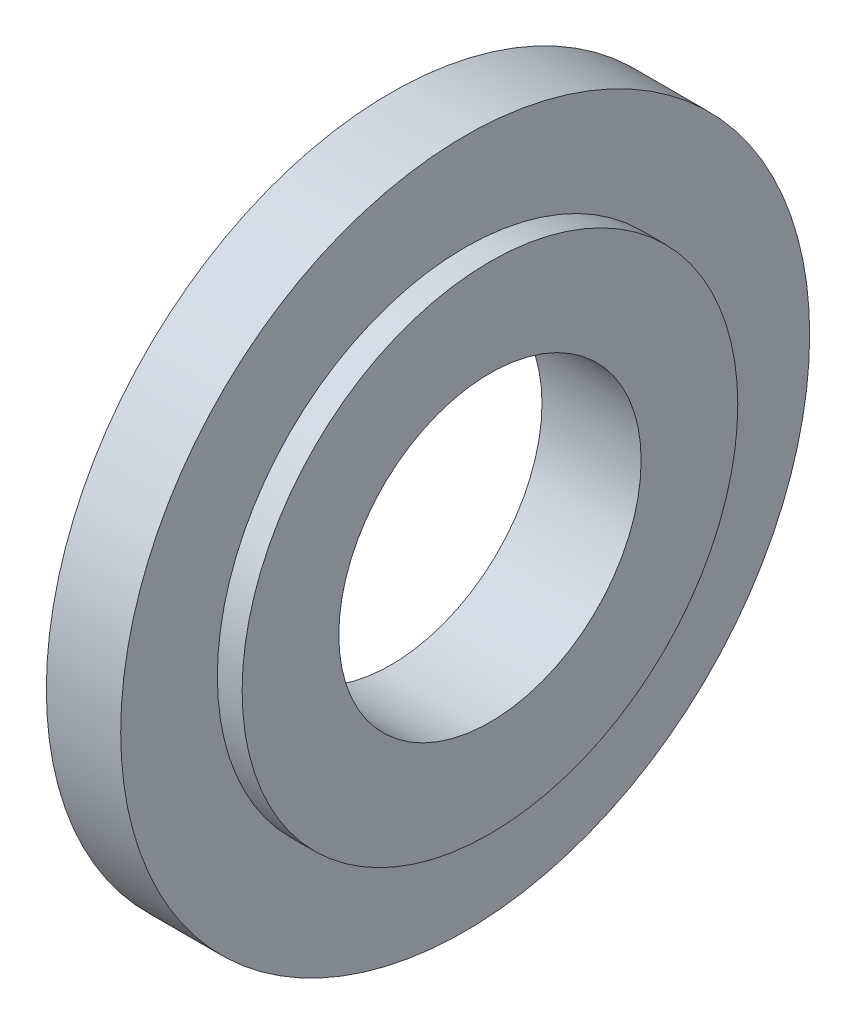
from build123d import *

# Parameters (mm, degrees)
FORMSENKUNG_F_R_M3_SENKSCHRAUBE_MIT_INNE_D           = 3.4
FORMSENKUNG_F_R_M3_SENKSCHRAUBE_MIT_INNE_CSINK_D     = 5.7
FORMSENKUNG_F_R_M3_SENKSCHRAUBE_MIT_INNE_CSINK_ANGLE = 90
KREISMUSTER1_COUNT                                   = 4
SKIZZE5_R                                            = 24.563351151
SKIZZE5_R_2                                          = 12.292484408
SCHNITT_LINEAR_AUSTRAGEN3_DEPTH                      = 32.128764833
SCHNITT_LINEAR_AUSTRAGEN5_DEPTH                      = 29.565713714
SCHNITT_LINEAR_AUSTRAGEN5_DEPTH_BACK                 = 29.565713714
SKIZZE12_R                                           = 25.145284477
SKIZZE12_R_2                                         = 13.9
SCHNITT_LINEAR_AUSTRAGEN6_DEPTH                      = 21.06040877
SCHNITT_LINEAR_AUSTRAGEN6_DEPTH_BACK                 = 21.06040877
SKIZZE13_R                                           = 6.1


with BuildPart() as part:
    # Skizze1 → Rotation1 (revolve)
    with BuildSketch(Plane.XY):
        Polygon((-30.239658347, 20), (-30.239658347, 6), (-26.239658347, 6), (-26.239658347, 10), (-27.239658347, 10), (-27.239658347, 14), (-14.239658347, 14), (-14.239658347, 20), align=None)
    revolve(axis=Axis((-37.668433178, 0, 0), (1, 0, 0)))

    # Formsenkung für M3 Senkschraube mit Innensechskant1 (through all)
    with Locations(Plane(origin=(-14.239658347, 0, 0), x_dir=(0, 0, -1), z_dir=(1, 0, 0))):
        with Locations((0, 17)):
            formsenkung_f_r_m3_senkschraube_mit_inne = CounterSinkHole(FORMSENKUNG_F_R_M3_SENKSCHRAUBE_MIT_INNE_D / 2, FORMSENKUNG_F_R_M3_SENKSCHRAUBE_MIT_INNE_CSINK_D / 2, counter_sink_angle=FORMSENKUNG_F_R_M3_SENKSCHRAUBE_MIT_INNE_CSINK_ANGLE)

    # Kreismuster1: Formsenkung für M3 Senkschraube mit Innensechskant1 ×4 about axis
    kreismuster1_axis = Axis((-14.239658347, 0, 0), (-1, 0, 0))
    for i in range(1, KREISMUSTER1_COUNT):
        add(formsenkung_f_r_m3_senkschraube_mit_inne.rotate(kreismuster1_axis, i * 360 / KREISMUSTER1_COUNT), mode=Mode.SUBTRACT)

    # Skizze5 → Schnitt-Linear austragen3 (cut, through all)
    with BuildSketch(Plane(origin=(-27.239658347, 0, 0), x_dir=(0, 0, -1), z_dir=(1, 0, 0))):
        Circle(SKIZZE5_R)
        Circle(SKIZZE5_R_2, mode=Mode.SUBTRACT)
    extrude(amount=SCHNITT_LINEAR_AUSTRAGEN3_DEPTH, mode=Mode.SUBTRACT)

    # Skizze12 → Schnitt-Linear austragen5 (cut, two sides: drawn at the far end of the back side and taken through both)
    with BuildSketch(Plane(origin=(-26.239658347, 0, 0), x_dir=(0, 0, -1), z_dir=(1, 0, 0)).offset(-SCHNITT_LINEAR_AUSTRAGEN5_DEPTH_BACK)):
        Circle(SKIZZE12_R)
        Circle(SKIZZE12_R_2, mode=Mode.SUBTRACT)
    extrude(amount=SCHNITT_LINEAR_AUSTRAGEN5_DEPTH + SCHNITT_LINEAR_AUSTRAGEN5_DEPTH_BACK, mode=Mode.SUBTRACT)

    # Skizze13 → Schnitt-Linear austragen6 (cut, two sides: drawn at the far end of the back side and taken through both)
    with BuildSketch(Plane(origin=(-26.239658347, 0, 0), x_dir=(0, 0, -1), z_dir=(1, 0, 0)).offset(-SCHNITT_LINEAR_AUSTRAGEN6_DEPTH_BACK)):
        Circle(SKIZZE13_R)
    extrude(amount=SCHNITT_LINEAR_AUSTRAGEN6_DEPTH + SCHNITT_LINEAR_AUSTRAGEN6_DEPTH_BACK, mode=Mode.SUBTRACT)


solid = part.part
